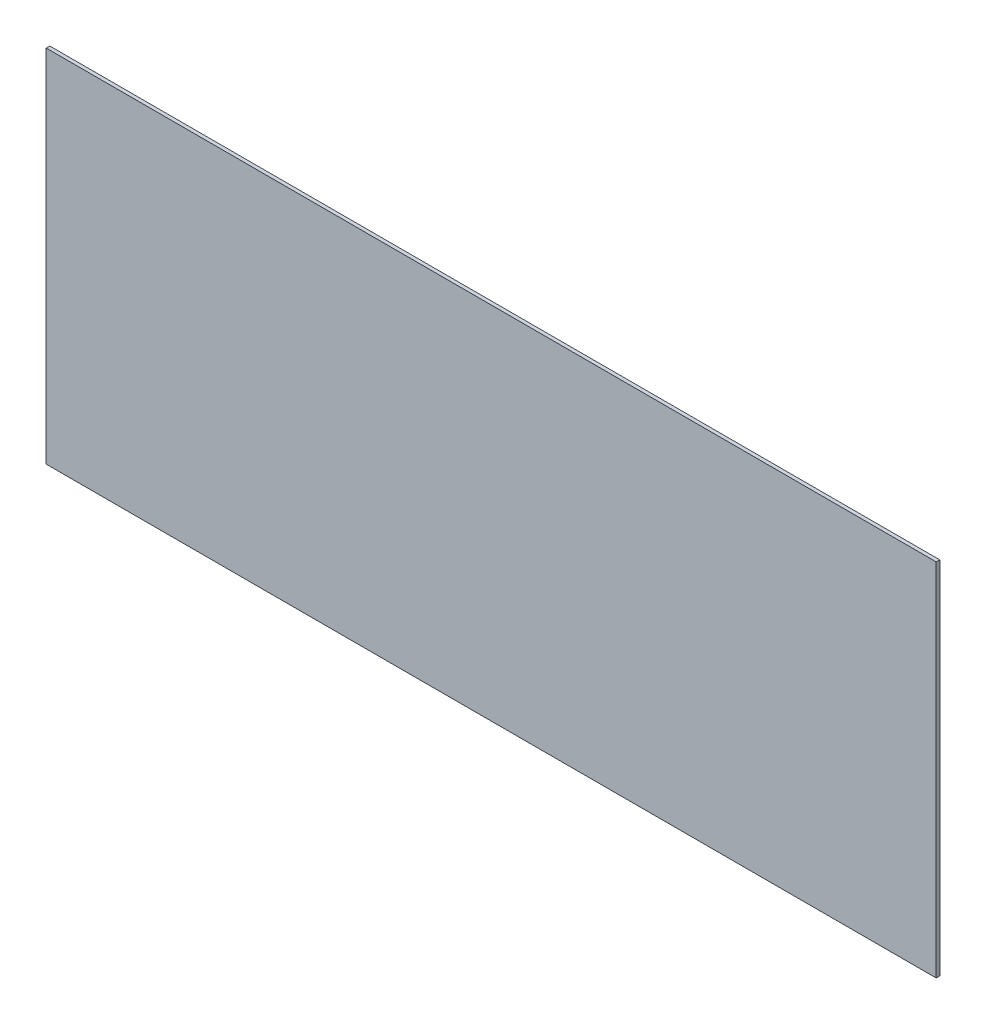
from build123d import *

# Parameters (mm, degrees)
ESBO_O1_W                = 500
ESBO_O1_H                = 202.46
RESSALTO_EXTRUS_O1_DEPTH = 2


with BuildPart() as part:
    # Esboço1 → Ressalto-extrusão1 (new body)
    with BuildSketch(Plane.XY):
        Rectangle(ESBO_O1_W, ESBO_O1_H)
    extrude(amount=RESSALTO_EXTRUS_O1_DEPTH)


solid = part.part
